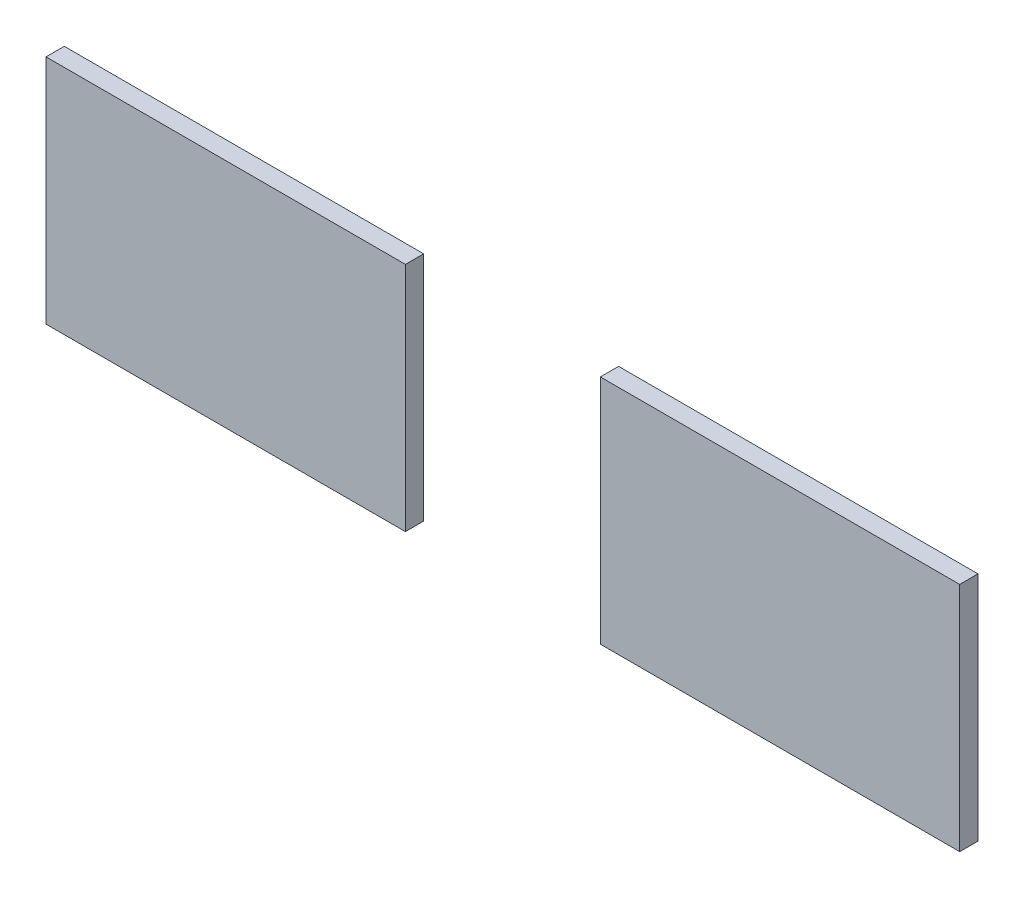
from build123d import *

# Parameters (mm, degrees)
SKETCH1_W             = 29.5
SKETCH1_H             = 19
BOSS_EXTRUDE1_DEPTH   = 1.5
BOSS_EXTRUDE1_2_DEPTH = 1.5


with BuildPart() as part:
    # Sketch1 → Boss-Extrude1 (new body)
    with BuildSketch(Plane.XY):
        with Locations((-49.613636364, -0.333333333)):
            Rectangle(SKETCH1_W, SKETCH1_H)
    extrude(amount=BOSS_EXTRUDE1_DEPTH)


with BuildPart() as body_2:
    # Sketch1 → Boss-Extrude1 2 (new body)
    with BuildSketch(Plane.XY):
        with Locations((-4.113636364, -0.333333333)):
            Rectangle(SKETCH1_W, SKETCH1_H)
    extrude(amount=BOSS_EXTRUDE1_2_DEPTH)


solid = Compound([part.part, body_2.part])
